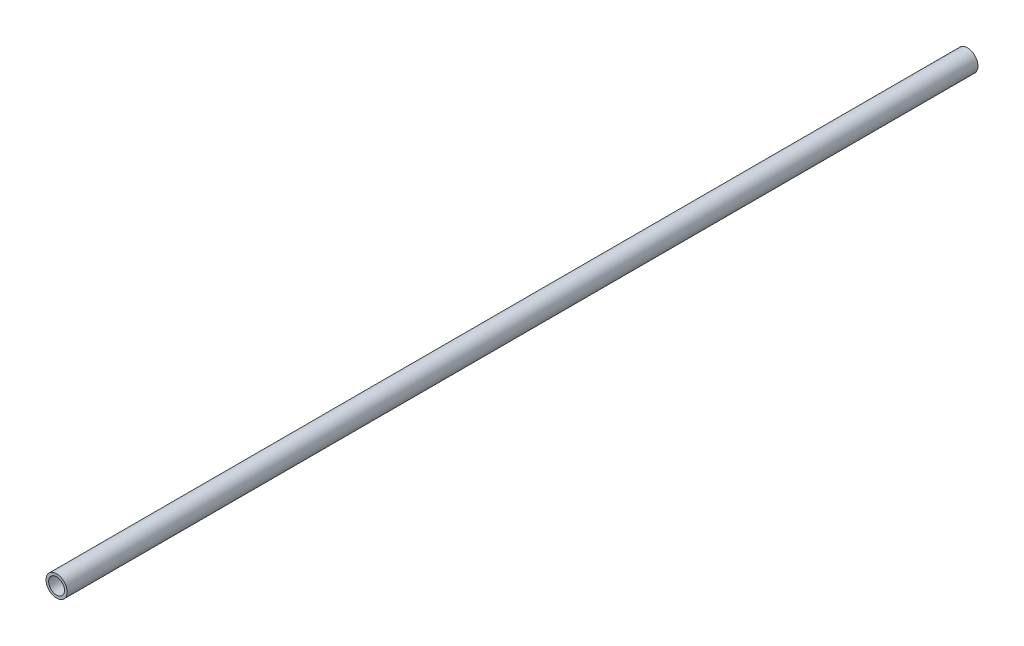
from build123d import *

# Parameters (mm, degrees)
SKETCH1_R           = 2
SKETCH1_R_2         = 1.5
BOSS_EXTRUDE1_DEPTH = 172


with BuildPart() as part:
    # Sketch1 → Boss-Extrude1 (new body)
    with BuildSketch(Plane.XY):
        Circle(SKETCH1_R)
        Circle(SKETCH1_R_2, mode=Mode.SUBTRACT)
    extrude(amount=BOSS_EXTRUDE1_DEPTH)


solid = part.part
